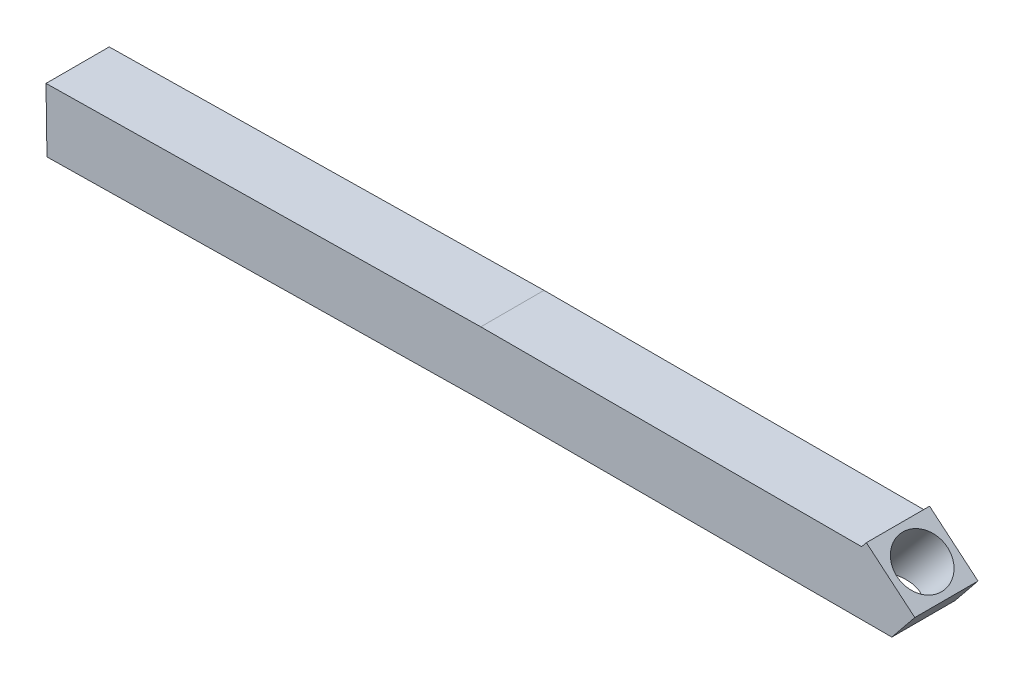
from build123d import *

# Parameters (mm, degrees)
BOSS_EXTRUDE1_DEPTH = 2.5
SKETCH2_R           = 1
CUT_EXTRUDE1_DEPTH  = 4.5
SKETCH3_R           = 1
CUT_EXTRUDE2_DEPTH  = 9.5
SKETCH5_R           = 1
BOSS_EXTRUDE2_DEPTH = 9.5
SKETCH7_W           = 2.5
SKETCH7_H           = 2.48697386
BOSS_EXTRUDE5_DEPTH = 17
SKETCH8_R           = 1
CUT_EXTRUDE3_DEPTH  = 9.5
SKETCH9_W           = 2.5
SKETCH9_H           = 2.510853282
CUT_EXTRUDE4_DEPTH  = 10.5
SKETCH10_R          = 1
CUT_EXTRUDE5_DEPTH  = 4.5
SKETCH11_R          = 1
BOSS_EXTRUDE6_DEPTH = 4.5
SKETCH12_R          = 1
CUT_EXTRUDE6_DEPTH  = 4
SKETCH13_W          = 2.5
SKETCH13_H          = 2.5
CUT_EXTRUDE7_DEPTH  = 6.5
SKETCH14_W          = 2.5
SKETCH14_H          = 2.5
BOSS_EXTRUDE7_DEPTH = 6.5
SKETCH15_R          = 1
CUT_EXTRUDE8_DEPTH  = 5
SKETCH16_R          = 1
BOSS_EXTRUDE8_DEPTH = 5
SKETCH17_W          = 2.5
SKETCH17_H          = 2.5
BOSS_EXTRUDE9_DEPTH = 17
SKETCH18_R          = 1
CUT_EXTRUDE9_DEPTH  = 5
SKETCH19_W          = 2.5
SKETCH19_H          = 2.5
CUT_EXTRUDE10_DEPTH = 6.3
SKETCH20_R          = 1
CUT_EXTRUDE11_DEPTH = 5


with BuildPart() as part:
    # Sketch1 → Boss-Extrude1 (new body)
    with BuildSketch(Plane.XY):
        Polygon((-70.406172668, -77.710060133), (-55.343173361, -77.710060133), (-55.155758053, -77.477979804), (-53.240646945, -79.084948828), (-54.148993857, -80.209773972), (-70.368347793, -80.209773972), align=None)
    extrude(amount=BOSS_EXTRUDE1_DEPTH)

    # Sketch2 → Cut-Extrude1 (cut)
    with BuildSketch(Plane(origin=(-60.939488189, -72.62485398, 0), x_dir=(0, 0, -1), z_dir=(0.6427876096865354, 0.7660444431189815, 0))):
        with Locations(Location((-1.25, -8.800123479, 0), (0, 0, 90))):
            Circle(SKETCH2_R)
    extrude(amount=-CUT_EXTRUDE1_DEPTH, mode=Mode.SUBTRACT)

    # Sketch3 → Cut-Extrude2 (cut)
    with BuildSketch(Plane(origin=(-71.565670343, -1.082908957, 0), x_dir=(0, 0, 1), z_dir=(-0.9998855357578962, -0.015129949839474955, 0))):
        with Locations(Location((1.25, -77.885923249, 0), (0, 0, 270))):
            Circle(SKETCH3_R)
    extrude(amount=-CUT_EXTRUDE2_DEPTH, mode=Mode.SUBTRACT)

    # Sketch5 → Boss-Extrude2 (add)
    with BuildSketch(Plane(origin=(-71.565670343, -1.082908957, 0), x_dir=(0, 0, 1), z_dir=(-0.9998855357578961, -0.015129949839476386, 0))):
        with Locations((1.25, -77.885923249)):
            Circle(SKETCH5_R)
    extrude(amount=-BOSS_EXTRUDE2_DEPTH)

    # Sketch7 → Boss-Extrude5 (add)
    with BuildSketch(Plane(origin=(-71.565670343, -1.082908957, 0), x_dir=(0, 0, 1), z_dir=(-0.9998855357578961, -0.015129949839476386, 0))):
        with Locations((1.25, -77.879410179)):
            Rectangle(SKETCH7_W, SKETCH7_H)
    extrude(amount=BOSS_EXTRUDE5_DEPTH)

    # Sketch8 → Cut-Extrude3 (cut)
    with BuildSketch(Plane(origin=(-88.56372445, -1.340118104, 0), x_dir=(0, 0, 1), z_dir=(-0.9998855357578962, -0.015129949839480206, 0))):
        with Locations(Location((1.25, -77.885923249, 0), (0, 0, 270))):
            Circle(SKETCH8_R)
    extrude(amount=-CUT_EXTRUDE3_DEPTH, mode=Mode.SUBTRACT)

    # Sketch9 → Cut-Extrude4 (cut)
    with BuildSketch(Plane(origin=(-88.56372445, -1.340118104, 0), x_dir=(0, 0, 1), z_dir=(-0.9998855357578962, -0.015129949839480206, 0))):
        with Locations((1.25, -77.89134989)):
            Rectangle(SKETCH9_W, SKETCH9_H)
    extrude(amount=-CUT_EXTRUDE4_DEPTH, mode=Mode.SUBTRACT)

    # Sketch10 → Cut-Extrude5 (cut)
    with BuildSketch(Plane(origin=(-78.064926325, -1.181253631, 0), x_dir=(0, 0, 1), z_dir=(-0.9998855357578961, -0.015129949839478678, 0))):
        with Locations(Location((1.25, -77.885923249, 0), (0, 0, 270))):
            Circle(SKETCH10_R)
    extrude(amount=-CUT_EXTRUDE5_DEPTH, mode=Mode.SUBTRACT)

    # Sketch11 → Boss-Extrude6 (add)
    with BuildSketch(Plane(origin=(-78.064926325, -1.181253631, 0), x_dir=(0, 0, 1), z_dir=(-0.9998855357578961, -0.015129949839478678, 0))):
        with Locations((1.25, -77.885923249)):
            Circle(SKETCH11_R)
    extrude(amount=-BOSS_EXTRUDE6_DEPTH)

    # Sketch12 → Cut-Extrude6 (cut)
    with BuildSketch(Plane(origin=(-78.064926325, -1.181253631, 0), x_dir=(0, 0, 1), z_dir=(-0.9998855357578961, -0.015129949839478678, 0))):
        with Locations(Location((1.25, -77.885923249, 0), (0, 0, 270))):
            Circle(SKETCH12_R)
    extrude(amount=-CUT_EXTRUDE6_DEPTH, mode=Mode.SUBTRACT)

    # Sketch13 → Cut-Extrude7 (cut)
    with BuildSketch(Plane(origin=(-78.064926325, -1.181253631, 0), x_dir=(0, 0, 1), z_dir=(-0.9998855357578961, -0.015129949839478678, 0))):
        with Locations((1.25, -77.885923249)):
            Rectangle(SKETCH13_W, SKETCH13_H)
    extrude(amount=-CUT_EXTRUDE7_DEPTH, mode=Mode.SUBTRACT)

    # Sketch14 → Boss-Extrude7 (add)
    with BuildSketch(Plane(origin=(-71.565670343, -1.082908957, 0), x_dir=(0, 0, 1), z_dir=(-0.9998855357578961, -0.015129949839476386, 0))):
        with Locations((1.25, -77.885923249)):
            Rectangle(SKETCH14_W, SKETCH14_H)
    extrude(amount=BOSS_EXTRUDE7_DEPTH)

    # Sketch15 → Cut-Extrude8 (cut)
    with BuildSketch(Plane(origin=(-78.064926325, -1.181253631, 0), x_dir=(0, 0, 1), z_dir=(-0.9998855357578961, -0.01512994983947622, 0))):
        with Locations(Location((1.25, -77.885923249, 0), (0, 0, 270))):
            Circle(SKETCH15_R)
    extrude(amount=-CUT_EXTRUDE8_DEPTH, mode=Mode.SUBTRACT)

    # Sketch16 → Boss-Extrude8 (add)
    with BuildSketch(Plane(origin=(-78.064926325, -1.181253631, 0), x_dir=(0, 0, 1), z_dir=(-0.9998855357578961, -0.01512994983947622, 0))):
        with Locations((1.25, -77.885923249)):
            Circle(SKETCH16_R)
    extrude(amount=-BOSS_EXTRUDE8_DEPTH)

    # Sketch17 → Boss-Extrude9 (add)
    with BuildSketch(Plane(origin=(-78.064926325, -1.181253631, 0), x_dir=(0, 0, 1), z_dir=(-0.9998855357578961, -0.01512994983947622, 0))):
        with Locations((1.25, -77.885923249)):
            Rectangle(SKETCH17_W, SKETCH17_H)
    extrude(amount=BOSS_EXTRUDE9_DEPTH)

    # Sketch18 → Cut-Extrude9 (cut)
    with BuildSketch(Plane(origin=(-95.062980433, -1.438462778, 0), x_dir=(0, 0, 1), z_dir=(-0.9998855357578961, -0.01512994983947622, 0))):
        with Locations(Location((1.25, -77.885923249, 0), (0, 0, 270))):
            Circle(SKETCH18_R)
    extrude(amount=-CUT_EXTRUDE9_DEPTH, mode=Mode.SUBTRACT)

    # Sketch19 → Cut-Extrude10 (cut)
    with BuildSketch(Plane(origin=(-95.062980433, -1.438462778, 0), x_dir=(0, 0, 1), z_dir=(-0.9998855357578961, -0.01512994983947622, 0))):
        with Locations((1.25, -77.885923249)):
            Rectangle(SKETCH19_W, SKETCH19_H)
    extrude(amount=-CUT_EXTRUDE10_DEPTH, mode=Mode.SUBTRACT)

    # Sketch20 → Cut-Extrude11 (cut)
    with BuildSketch(Plane(origin=(-88.763701558, -1.343144094, 0), x_dir=(0, 0, 1), z_dir=(-0.9998855357578961, -0.015129949839476473, 0))):
        with Locations(Location((1.25, -77.885923249, 0), (0, 0, 270))):
            Circle(SKETCH20_R)
    extrude(amount=-CUT_EXTRUDE11_DEPTH, mode=Mode.SUBTRACT)


solid = part.part
